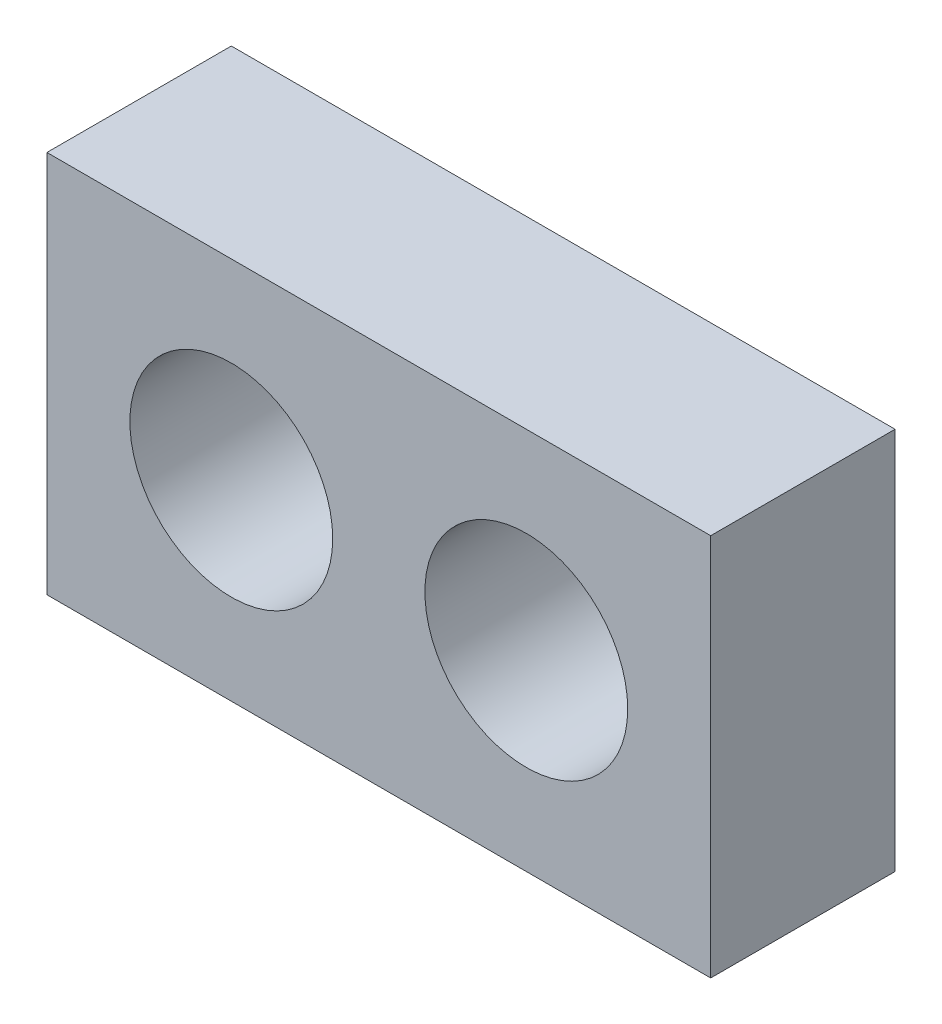
from build123d import *

# Parameters (mm, degrees)
SKETCH2_W           = 18
SKETCH2_H           = 10.387639571
SKETCH2_R           = 2.75
BOSS_EXTRUDE1_DEPTH = 5


with BuildPart() as part:
    # Sketch2 → Boss-Extrude1 (new body)
    with BuildSketch(Plane.XY):
        with Locations((-5.891655166, 5.193819786)):
            Rectangle(SKETCH2_W, SKETCH2_H)
        with Locations((-9.891655166, 5.193819785)):
            Circle(SKETCH2_R, mode=Mode.SUBTRACT)
        with Locations((-1.891655166, 5.193819785)):
            Circle(SKETCH2_R, mode=Mode.SUBTRACT)
    extrude(amount=BOSS_EXTRUDE1_DEPTH)


solid = part.part
